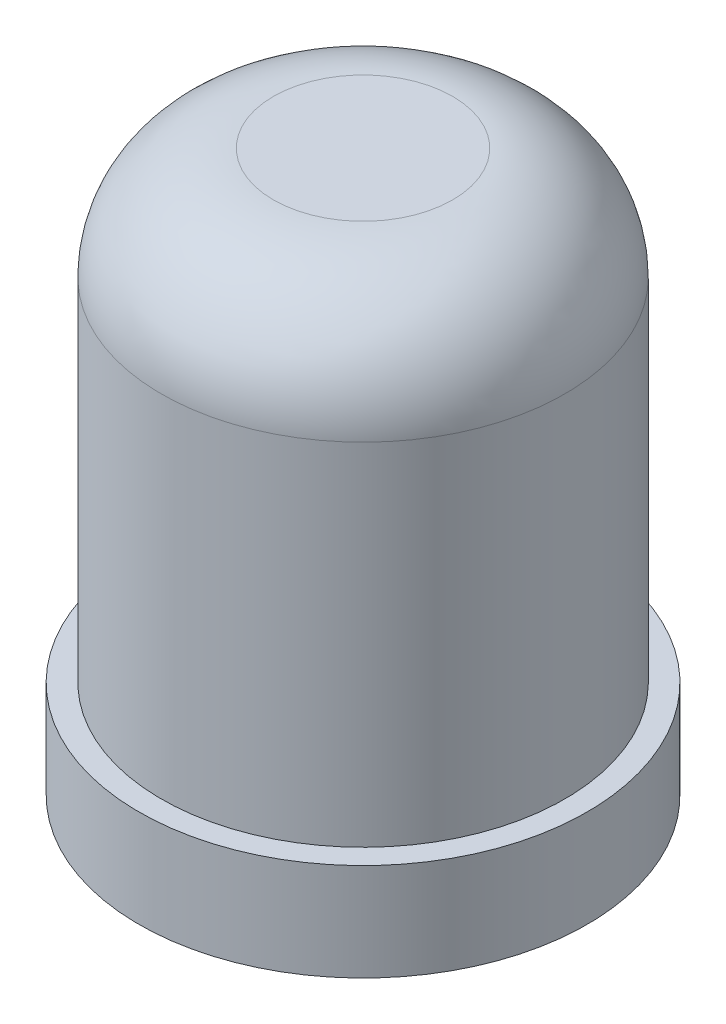
from build123d import *


with BuildPart() as part:
    # Çizim1 → Döndür2 (revolve)
    with BuildSketch(Plane.XY, mode=Mode.PRIVATE) as d_nd_r2_sk:
        with BuildLine():
            Line((0, 0), (10, 0))
            Line((10, 0), (10, 4.346574423))
            Line((10, 4.346574423), (9, 4.346574423))
            Line((9, 4.346574423), (9, 20))
            ThreePointArc((9, 20), (7.535533906, 23.535533906), (4, 25))
            Line((4, 25), (0, 25))
            Line((0, 25), (0, 0))
        make_face()
    revolve(d_nd_r2_sk.sketch.rotate(Axis((0, 25, 0), (0, -1, 0)), 180), axis=Axis((0, 25, 0), (0, -1, 0)))


solid = part.part
